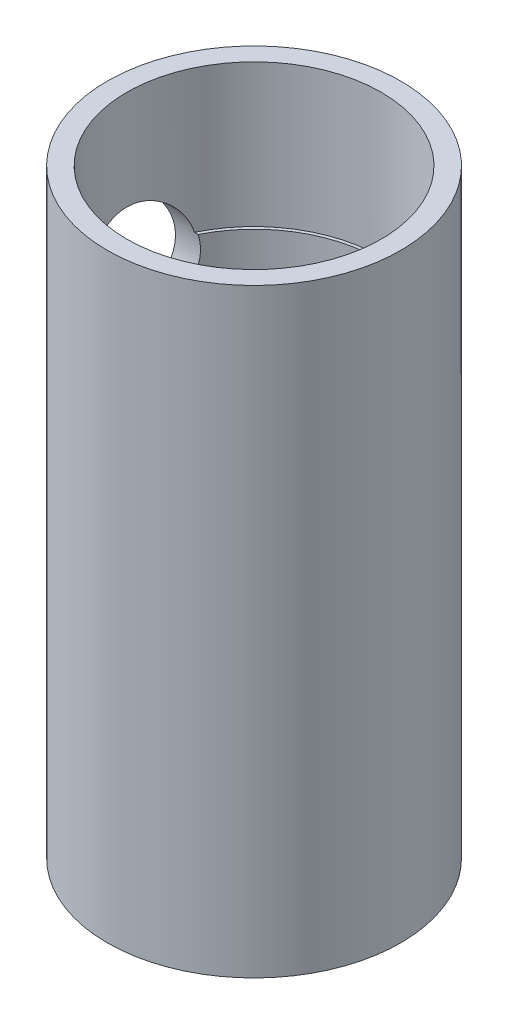
from build123d import *

# Parameters (mm, degrees)
SKETCH1_R           = 45.25
SKETCH1_R_2         = 38.25
BOSS_EXTRUDE1_DEPTH = 92.5
BOSS_EXTRUDE2_START = -6.35
SKETCH2_R           = 38.25
SKETCH2_R_2         = 36.25
BOSS_EXTRUDE2_DEPTH = 100
CUT_EXTRUDE3_START  = -44
SKETCH6_R           = 39.25
SKETCH6_R_2         = 38.25
CUT_EXTRUDE3_DEPTH  = 44
SKETCH7_R           = 17.5
CUT_EXTRUDE4_DEPTH  = 113.478331247


with BuildPart() as part:
    # Sketch1 → Boss-Extrude1 (new, symmetric)
    with BuildSketch(Plane(origin=(0, 0, 0), x_dir=(1, 0, 0), z_dir=(0, 1, 0))):
        with Locations(Location((0, 0, 0), (0, 0, 270))):
            Circle(SKETCH1_R)
        with Locations(Location((0, 0, 0), (0, 0, 270))):
            Circle(SKETCH1_R_2, mode=Mode.SUBTRACT)
    extrude(amount=BOSS_EXTRUDE1_DEPTH, both=True)

    # Sketch2 → Boss-Extrude2 (add)
    with BuildSketch(Plane.XZ.offset(92.5).offset(BOSS_EXTRUDE2_START)):
        with Locations(Location((0, 0, 0), (0, 0, 270))):
            Circle(SKETCH2_R)
        with Locations(Location((0, 0, 0), (0, 0, 270))):
            Circle(SKETCH2_R_2, mode=Mode.SUBTRACT)
    extrude(amount=-BOSS_EXTRUDE2_DEPTH)

    # Sketch6 → Cut-Extrude3 (cut)
    with BuildSketch(Plane(origin=(0, 92.5, 0), x_dir=(1, 0, 0), z_dir=(0, 1, 0)).offset(CUT_EXTRUDE3_START)):
        with Locations(Location((0, 0, 0), (0, 0, 270))):
            Circle(SKETCH6_R)
        with Locations(Location((0, 0, 0), (0, 0, 90))):
            Circle(SKETCH6_R_2, mode=Mode.SUBTRACT)
    extrude(amount=CUT_EXTRUDE3_DEPTH, mode=Mode.SUBTRACT)

    # Sketch7 → Cut-Extrude4 (cut, through all)
    with BuildSketch(Plane(origin=(0, 0, 0), x_dir=(0, 0, -1), z_dir=(1, 0, 0))):
        with Locations(Location((0, 44.35, 0), (0, 0, 13.717970606))):
            Circle(SKETCH7_R)
    extrude(amount=-CUT_EXTRUDE4_DEPTH, mode=Mode.SUBTRACT)


solid = part.part
